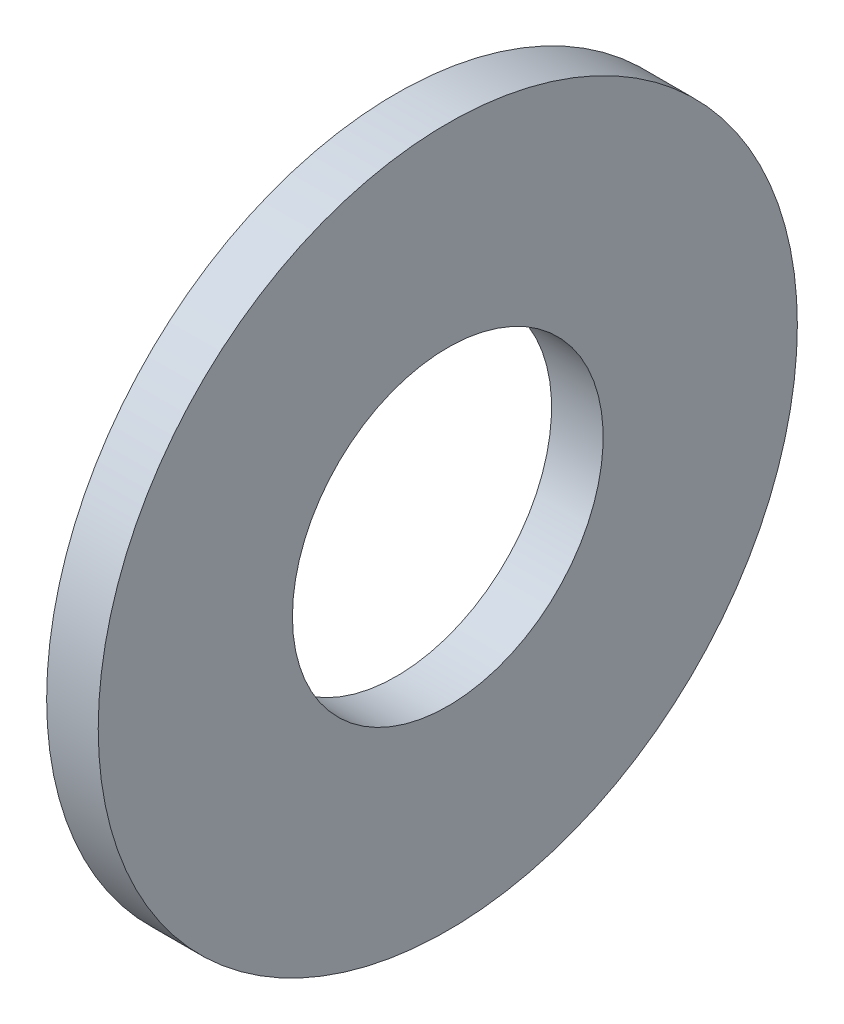
from build123d import *

# Parameters (mm, degrees)
SKETCH1_W = 2.1082
SKETCH1_H = 7.9375


with BuildPart() as part:
    # Sketch1 → Base-Revolve (revolve)
    with BuildSketch(Plane.XY, mode=Mode.PRIVATE) as base_revolve_sk:
        with Locations((-1.0541, 10.31875)):
            Rectangle(SKETCH1_W, SKETCH1_H)
    revolve(base_revolve_sk.sketch.rotate(Axis((-34.925, 0, 0), (1, 0, 0)), 90), axis=Axis((-34.925, 0, 0), (1, 0, 0)))


solid = part.part
